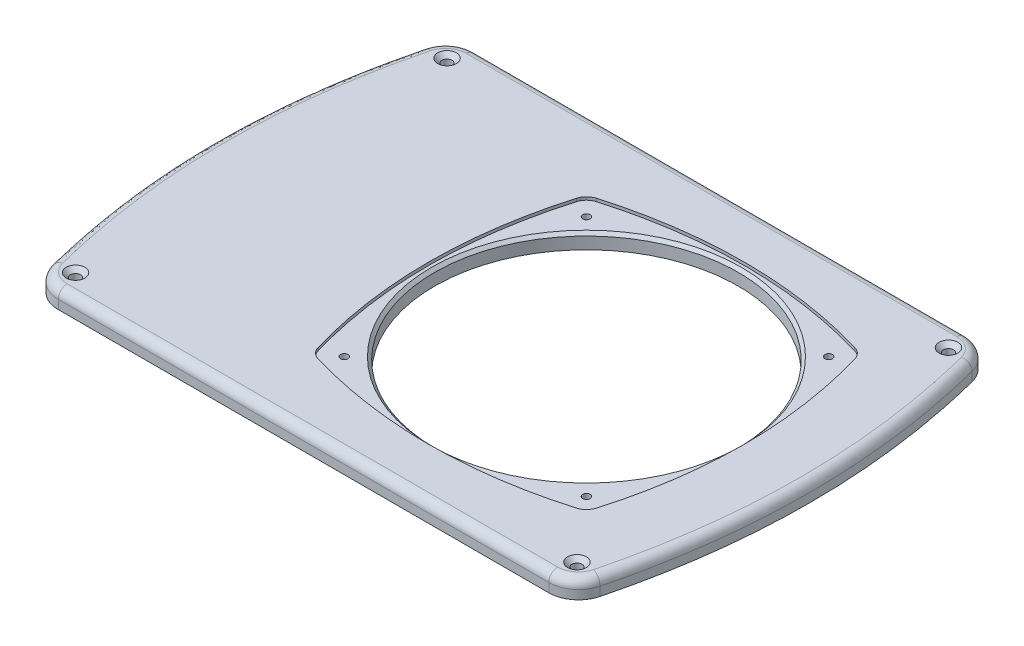
from build123d import *

# Parameters (mm, degrees)
BOSS_EXTRUDE1_DEPTH                             = 6
FILLET1_R                                       = 10
FILLET2_R                                       = 3
CUT_EXTRUDE1_REACH                              = 124.213
SKETCH2_R                                       = 51
M3X0_5_TAPPED_HOLE1_D                           = 2.5
SKETCH2_3_R                                     = 51
CUT_EXTRUDE2_DEPTH                              = 1
FILLET3_R                                       = 5
CSK_FOR_M3_FLAT_HEAD_MACHINE_SCREW6_D           = 3.4
CSK_FOR_M3_FLAT_HEAD_MACHINE_SCREW6_CSINK_D     = 6.3
CSK_FOR_M3_FLAT_HEAD_MACHINE_SCREW6_CSINK_ANGLE = 90
CHAMFER1_SIZE                                   = 1


with BuildPart() as part:
    # Sketch1 → Boss-Extrude1 (new body)
    with BuildSketch(Plane(origin=(0, 0, 0), x_dir=(1, 0, 0), z_dir=(0, 1, 0))):
        with BuildLine():
            Line((-90, 70), (90, 70))
            add(Edge.make_bspline(
                [(90, 70), (110, 0), (90, -70)],
                knots=[0, 0, 0, 1, 1, 1], degree=2))
            Line((90, -70), (-90, -70))
            add(Edge.make_bspline(
                [(-90, 70), (-110, 0), (-90, -70)],
                knots=[0, 0, 0, 1, 1, 1], degree=2))
        make_face()
    extrude(amount=BOSS_EXTRUDE1_DEPTH)

    # Fillet1
    fillet1_edges = [part.edges().sort_by_distance(p)[0] for p in [
        (-90, 3, -70),
        (90, 3, -70),
        (90, 3, 70),
        (-90, 3, 70),
    ]]
    fillet(fillet1_edges, radius=FILLET1_R)

    # Fillet2
    fillet2_edges = [part.edges().sort_by_distance(p)[0] for p in [
        (-100, 6, -3e-09),
        (0, 6, -70),
        (100, 6, -3e-09),
        (0, 6, 70),
        (-88.48120263, 6, 67.896446056),
        (88.48120263, 6, 67.896446056),
        (88.48120263, 6, -67.896446056),
        (-88.48120263, 6, -67.896446056),
    ]]
    fillet(fillet2_edges, radius=FILLET2_R)

    # Sketch2 → Cut-Extrude1 (cut, up to next)
    with BuildSketch(Plane(origin=(0, 6, 0), x_dir=(1, 0, 0), z_dir=(0, 1, 0)), mode=Mode.PRIVATE) as cut_extrude1_sk1:
        with Locations(Location((25, 0, 0), (0, 0, 270))):
            Circle(SKETCH2_R)
    cut_extrude1_tool1 = extrude(cut_extrude1_sk1.sketch, amount=-CUT_EXTRUDE1_REACH, mode=Mode.PRIVATE) & part.part
    add(cut_extrude1_tool1.solids().sort_by_distance((25, 6, 0))[0], mode=Mode.SUBTRACT)

    # M3x0.5 Tapped Hole1 (through all)
    with Locations(Plane(origin=(65.658639918, 6, -40.658639918), x_dir=(0, 0, 1), z_dir=(0, 1, 0))):
        with Locations((0, 0), (81.317279836, 0), (81.317279836, -81.317279836), (0, -81.317279836)):
            Hole(M3X0_5_TAPPED_HOLE1_D / 2)

    # Sketch2<3> → Cut-Extrude2 (cut)
    with BuildSketch(Plane(origin=(0, 6, 0), x_dir=(1, 0, 0), z_dir=(0, 1, 0))):
        with BuildLine():
            add(Edge.make_bspline(
                [(-20.961940777, 45.961940777), (-35.038059223, 0), (-20.961940777, -45.961940777)],
                knots=[0, 0, 0, 1, 1, 1], degree=2))
            add(Edge.make_bspline(
                [(70.961940777, -45.961940777), (25, -60.038059223), (-20.961940777, -45.961940777)],
                knots=[0, 0, 0, 1, 1, 1], degree=2))
            add(Edge.make_bspline(
                [(70.961940777, 45.961940777), (85.038059223, 0), (70.961940777, -45.961940777)],
                knots=[0, 0, 0, 1, 1, 1], degree=2))
            add(Edge.make_bspline(
                [(-20.961940777, 45.961940777), (25, 60.038059223), (70.961940777, 45.961940777)],
                knots=[0, 0, 0, 1, 1, 1], degree=2))
        make_face()
        with Locations(Location((25, 0, 0), (0, 0, 270))):
            Circle(SKETCH2_3_R, mode=Mode.SUBTRACT)
    extrude(amount=-CUT_EXTRUDE2_DEPTH, mode=Mode.SUBTRACT)

    # Fillet3
    fillet3_edges = [part.edges().sort_by_distance(p)[0] for p in [
        (-20.961940777, 5.5, 45.961940777),
        (70.961940777, 5.5, 45.961940777),
        (70.961940777, 5.5, -45.961940777),
        (-20.961940777, 5.5, -45.961940777),
    ]]
    fillet(fillet3_edges, radius=FILLET3_R)

    # CSK for M3 Flat Head Machine Screw6 (through all)
    with Locations(Plane(origin=(0, 6, 0), x_dir=(1, 0, 0), z_dir=(0, 1, 0))):
        with Locations((-84.186251123, 62.368933817), (84.186251123, 62.368933817), (84.186251123, -62.368933817), (-84.186251123, -62.368933817)):
            CounterSinkHole(CSK_FOR_M3_FLAT_HEAD_MACHINE_SCREW6_D / 2, CSK_FOR_M3_FLAT_HEAD_MACHINE_SCREW6_CSINK_D / 2, counter_sink_angle=CSK_FOR_M3_FLAT_HEAD_MACHINE_SCREW6_CSINK_ANGLE)

    # Chamfer1
    chamfer1_edges = [part.edges().sort_by_distance(p)[0] for p in [
        (25, 5, -51),
    ]]
    chamfer(chamfer1_edges, length=CHAMFER1_SIZE)


solid = part.part
